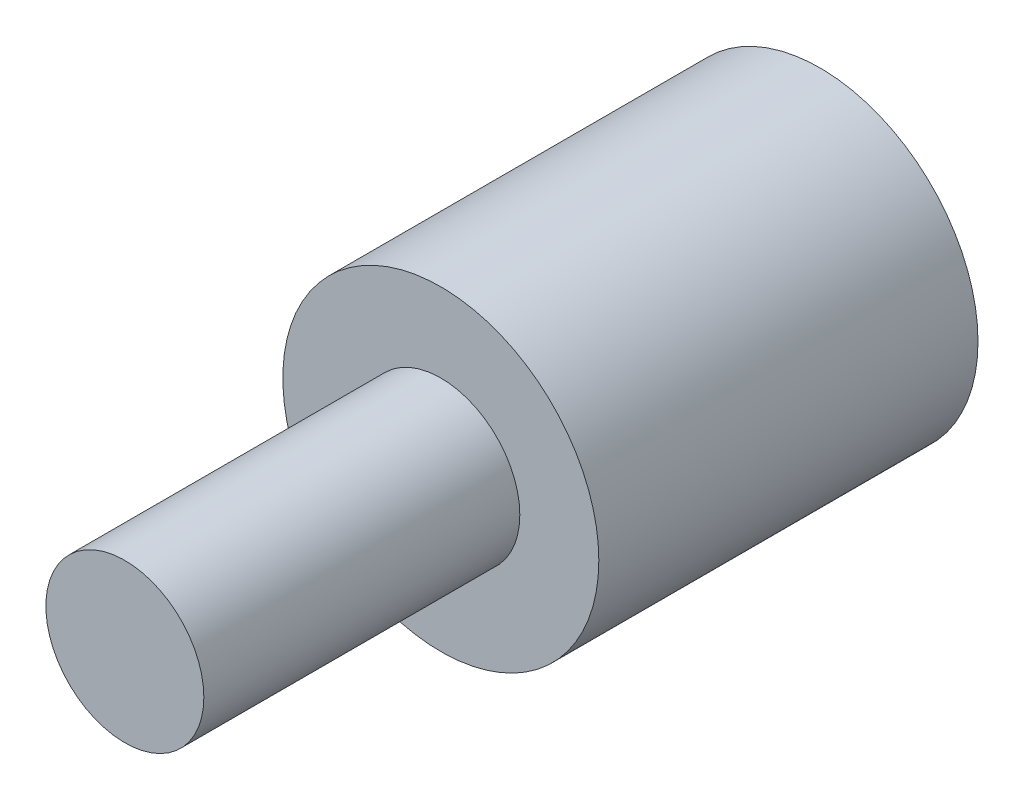
from build123d import *

# Parameters (mm, degrees)
SKETCH1_R           = 25
BOSS_EXTRUDE1_DEPTH = 60
SKETCH2_R           = 12.5
BOSS_EXTRUDE2_DEPTH = 50


with BuildPart() as part:
    # Sketch1 → Boss-Extrude1 (new body)
    with BuildSketch(Plane.XY):
        Circle(SKETCH1_R)
    extrude(amount=-BOSS_EXTRUDE1_DEPTH)

    # Sketch2 → Boss-Extrude2 (add)
    with BuildSketch(Plane.XY):
        Circle(SKETCH2_R)
    extrude(amount=BOSS_EXTRUDE2_DEPTH)


solid = part.part
